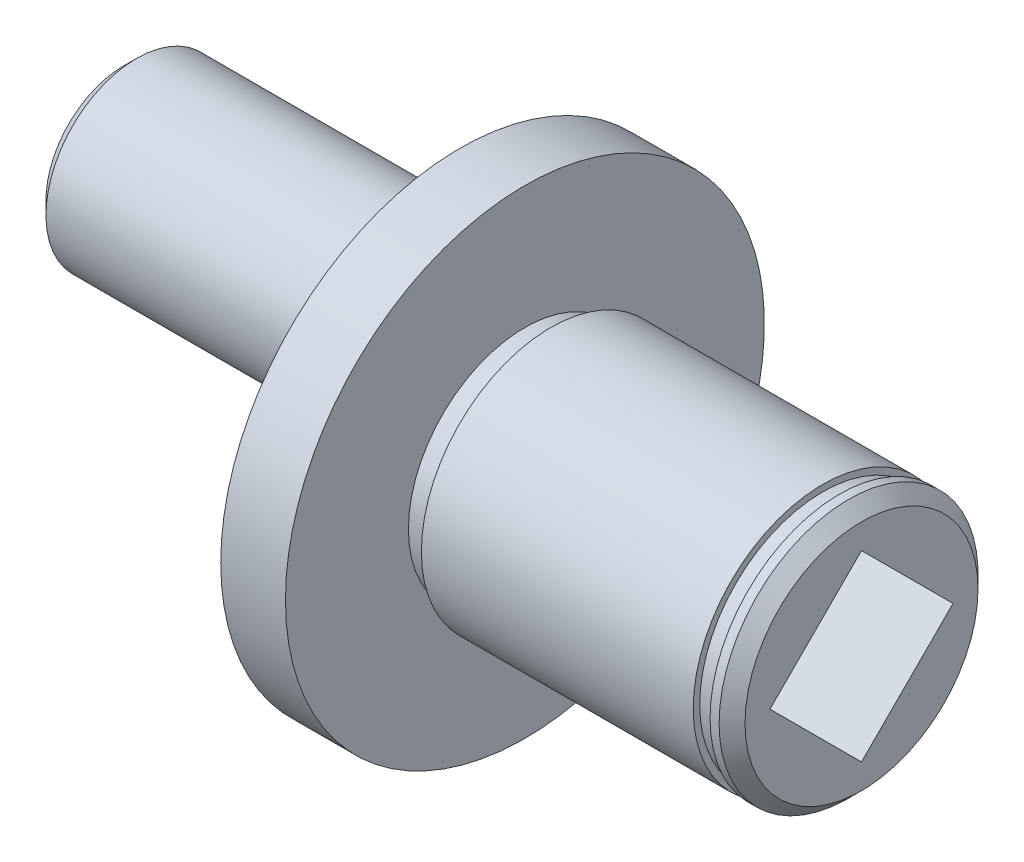
from build123d import *

# Parameters (mm, degrees)
PER_AGE5_D              = 10
PER_AGE5_DEPTH          = 17
PER_AGE5_TIP            = 3.004303095
ENL_V_MAT_EXTRU_1_DEPTH = 12


with BuildPart() as part:
    # Esquisse1 → Base-Révolution (revolve)
    with BuildSketch(Plane.XY, mode=Mode.PRIVATE) as base_r_volution_sk:
        Polygon((0, 0), (0, 18.5), (5, 18.5), (5, 9), (7, 9), (7, 10), (28, 10), (28, 9.5), (29.3, 9.5), (29.3, 10), (30, 10), (31, 9), (31, 0), align=None)
    revolve(base_r_volution_sk.sketch.rotate(Axis((0, 0, 0), (1, 0, 0)), 90), axis=Axis((0, 0, 0), (1, 0, 0)))

    # Esquisse2 → Boss.-Révol.1 (revolve)
    with BuildSketch(Plane.XY):
        Polygon((-26, 5), (-26, 11), (-25, 12), (-2, 12), (-2, 11), (0, 11), (0, 5), align=None)
    revolve(axis=Axis((0, 5, 0), (-1, 0, 0)))

    # Perçage5
    with Locations(Plane(origin=(31, 0, 0), x_dir=(0, 0, -1), z_dir=(1, 0, 0))):
        with Locations((0, 0)):
            Hole(PER_AGE5_D / 2, depth=PER_AGE5_DEPTH)
            with Locations((0, 0, -(PER_AGE5_DEPTH + PER_AGE5_TIP / 2))):  # 118° drill point
                Cone(0, PER_AGE5_D / 2, PER_AGE5_TIP, mode=Mode.SUBTRACT)

    # Esquisse5 → Enlèv. mat.-Extru.1 (cut)
    with BuildSketch(Plane(origin=(31, 0.918663762, 3.195352215), x_dir=(0, 0, -1), z_dir=(1, 0, 0))):
        Polygon((-3.875715597, -0.918663762), (3.195352215, 6.15240405), (10.266420027, -0.918663762), (3.195352215, -7.989731574), align=None)
    extrude(amount=-ENL_V_MAT_EXTRU_1_DEPTH, mode=Mode.SUBTRACT)


solid = part.part
